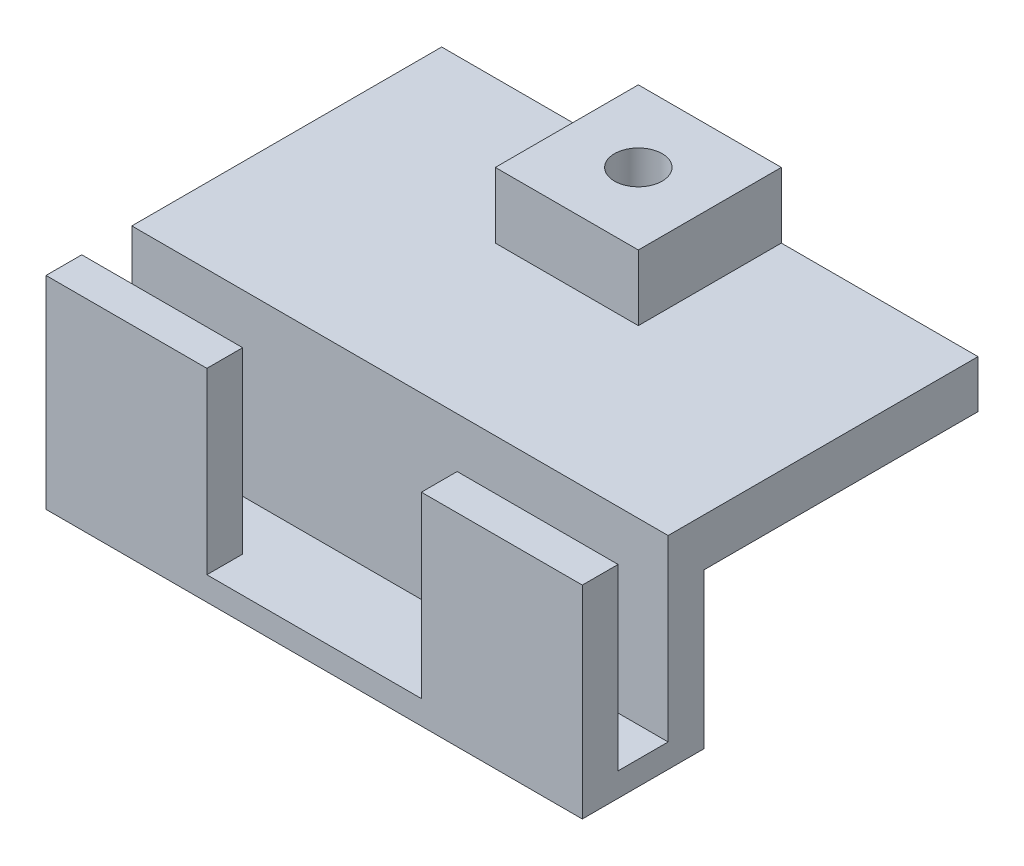
from build123d import *

# Parameters (mm, degrees)
SKETCH1_W      = 45
SKETCH1_H      = 10.2
EXTRUDE1_DEPTH = 2
SKETCH2_W      = 13.5
SKETCH2_H      = 3
SKETCH2_W_2    = 45
EXTRUDE2_DEPTH = 15
SKETCH3_W      = 45
SKETCH3_H      = 4
EXTRUDE3_DEPTH = 23
SKETCH6_W      = 12
SKETCH6_H      = 12
EXTRUDE4_DEPTH = 5.5
SKETCH7_R      = 2
EXTRUDE5_DEPTH = 5.5


with BuildPart() as part:
    # Sketch1 → Extrude1 (new body)
    with BuildSketch(Plane(origin=(0, 0, 0), x_dir=(1, 0, 0), z_dir=(0, 1, 0))):
        Rectangle(SKETCH1_W, SKETCH1_H)
    extrude(amount=EXTRUDE1_DEPTH)

    # Sketch2 → Extrude2 (add)
    with BuildSketch(Plane(origin=(0, 2, 0), x_dir=(1, 0, 0), z_dir=(0, 1, 0))):
        with Locations((-15.75, -3.6)):
            Rectangle(SKETCH2_W, SKETCH2_H)
        with Locations((15.75, -3.6)):
            Rectangle(SKETCH2_W, SKETCH2_H)
        with Locations((0, 3.6)):
            Rectangle(SKETCH2_W_2, SKETCH2_H)
    extrude(amount=EXTRUDE2_DEPTH)

    # Sketch3 → Extrude3 (add)
    with BuildSketch(Plane(origin=(0, 0, -5.1), x_dir=(-1, 0, 0), z_dir=(0, 0, -1))):
        with Locations((0, 15)):
            Rectangle(SKETCH3_W, SKETCH3_H)
    extrude(amount=EXTRUDE3_DEPTH)

    # Sketch6 → Extrude4 (add)
    with BuildSketch(Plane(origin=(0, 17, 0), x_dir=(1, 0, 0), z_dir=(0, 1, 0))):
        with Locations((0, 22.1)):
            Rectangle(SKETCH6_W, SKETCH6_H)
    extrude(amount=EXTRUDE4_DEPTH)

    # Sketch7 → Extrude5 (cut)
    with BuildSketch(Plane(origin=(0, 22.5, 0), x_dir=(1, 0, 0), z_dir=(0, 1, 0))):
        with Locations(Location((0, 22.1, 0), (0, 0, 270))):
            Circle(SKETCH7_R)
    extrude(amount=-EXTRUDE5_DEPTH, mode=Mode.SUBTRACT)


solid = part.part
